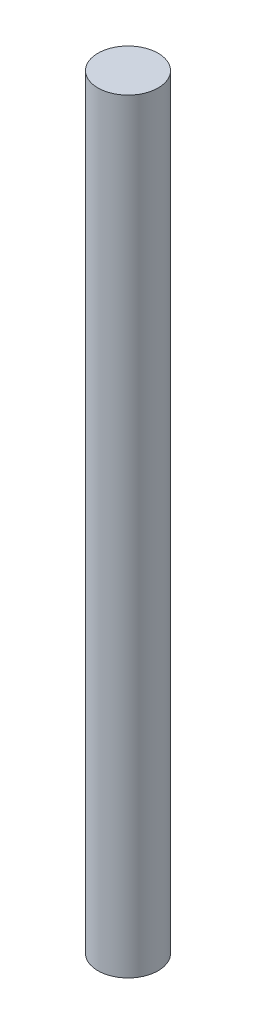
from build123d import *

# Parameters (mm, degrees)
SKETCH1_R           = 1.999996
BOSS_EXTRUDE1_DEPTH = 50.8


with BuildPart() as part:
    # Sketch1 → Boss-Extrude1 (new body)
    with BuildSketch(Plane(origin=(0, 0, 0), x_dir=(1, 0, 0), z_dir=(0, 1, 0))):
        with Locations(Location((0, 0, 0), (0, 0, 90))):
            Circle(SKETCH1_R)
    extrude(amount=BOSS_EXTRUDE1_DEPTH)


solid = part.part
